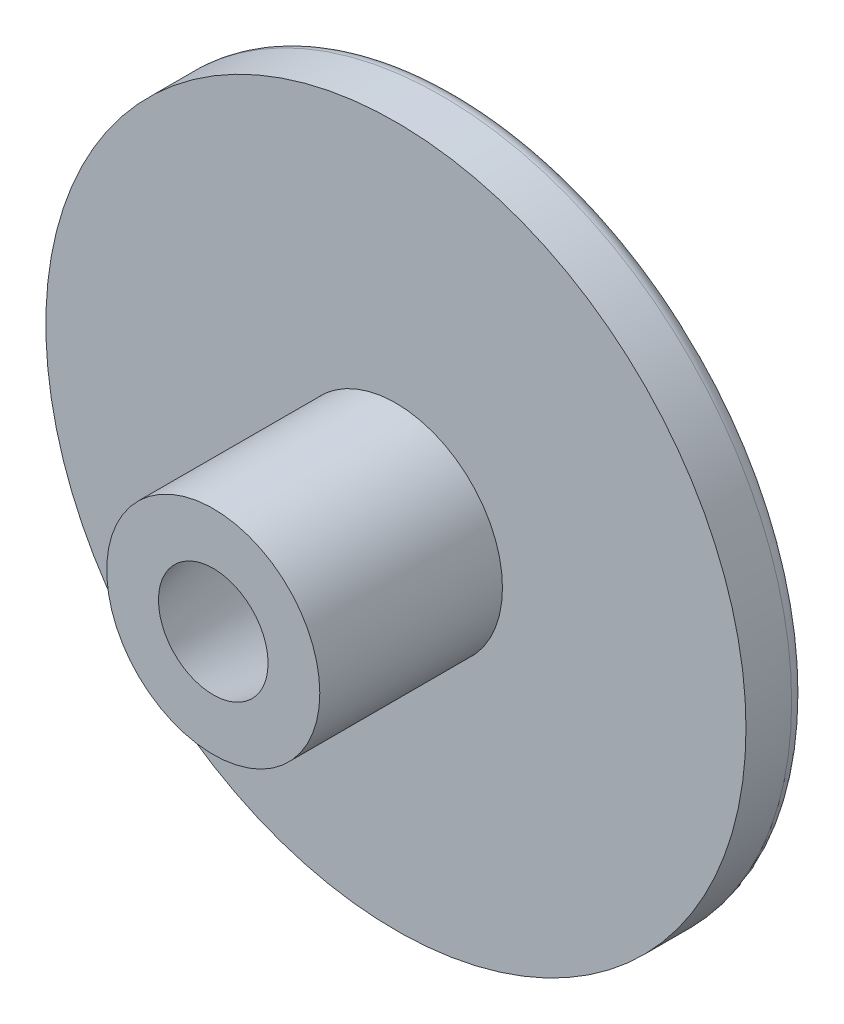
from build123d import *

# Parameters (mm, degrees)
ESQUISSE1_R             = 11.5
ESQUISSE1_R_2           = 3.5
EXTRU_MINCE1_DEPTH      = 2
BOSS_EXTRU_1_DEPTH      = 6
BOSS_EXTRU_1_DEPTH_BACK = 2
ESQUISSE2_R             = 3.5
ESQUISSE3_R             = 3.5
ENL_V_MAT_EXTRU_1_DEPTH = 8
ENL_V_MAT_EXTRU_1_DRAFT = -12
ENL_V_MAT_EXTRU_3_DEPTH = 0.5
CONG_1_R                = 0.5


with BuildPart() as part:
    # Esquisse1 → Extru.-Mince1 (new body)
    with BuildSketch(Plane.XY):
        Circle(ESQUISSE1_R)
        Circle(ESQUISSE1_R_2, mode=Mode.SUBTRACT)
    extrude(amount=EXTRU_MINCE1_DEPTH)

    # Esquisse4 → Enlèv. mat.-Extru.3 (cut)
    # profile 1 of 6: a face of its own
    with BuildSketch(Plane(origin=(0, 0, 0), x_dir=(-1, 0, 0), z_dir=(0, 0, -1))):
        with BuildLine():
            Line((8.614236144, 3.278675584), (8.788114349, 2.604897539))
            add(Edge.make_bspline(
                [(8.788114349, 2.604897539), (8.79966427, 2.559816951), (8.821835882, 2.47327876), (8.852021559, 2.348996491), (8.877355615, 2.235600173), (8.898549275, 2.133249532), (8.915365674, 2.04160878), (8.928351907, 1.961033259), (8.936436316, 1.891535911), (8.938580922, 1.848869045), (8.939556657, 1.829456834)],
                knots=[0, 0, 0, 0, 1.411457692, 2.709480947, 3.87888985, 4.935413449, 5.879444658, 6.704531935, 7.41059888, 8, 8, 8, 8], degree=3))
            add(Edge.make_bspline(
                [(8.939556657, 1.829456834), (8.939713797, 1.803271741), (8.940024383, 1.751517239), (8.9336806, 1.674798662), (8.92104517, 1.60048592), (8.902511857, 1.528353482), (8.879080272, 1.458194787), (8.848461369, 1.390638547), (8.81255859, 1.325278088), (8.771640938, 1.262234975), (8.724348427, 1.203389615), (8.672776946, 1.148695147), (8.61613876, 1.099238253), (8.554744757, 1.054751697), (8.488286054, 1.015567376), (8.416834995, 0.982290125), (8.341604793, 0.951861071), (8.288623452, 0.937334597), (8.261571881, 0.929917571)],
                knots=[0, 0, 0, 0, 1.027386749, 2.030616786, 3.016845276, 3.982381357, 4.951223185, 5.916105477, 6.889020454, 7.876144333, 8.861732762, 9.847961252, 10.823035865, 11.808325455, 12.819865946, 13.845613465, 14.899998771, 16, 16, 16, 16], degree=3))
            add(Edge.make_bspline(
                [(8.261571881, 0.929917571), (8.21642387, 0.920108041), (8.128211374, 0.900941679), (7.995026402, 0.89231684), (7.866216288, 0.903167406), (7.742160079, 0.930755896), (7.624921489, 0.977573896), (7.515745963, 1.041698092), (7.41700466, 1.124827685), (7.341957002, 1.206112608), (7.287706621, 1.281308893), (7.247452401, 1.344512835), (7.209843479, 1.415071454), (7.17363761, 1.491840234), (7.139016871, 1.575052601), (7.10707324, 1.665081978), (7.076215396, 1.761661179), (7.057526677, 1.828690991), (7.047930054, 1.86311068)],
                knots=[0, 0, 0, 0, 1.273361112, 2.487958111, 3.665382018, 4.829080103, 5.980857239, 7.134167278, 8.306407426, 9.529462913, 10.175565605, 10.86242879, 11.59517817, 12.379656551, 13.203449436, 14.08040443, 15.014291115, 16, 16, 16, 16], degree=3))
            Line((7.047930054, 1.86311068), (5.789416432, 0.239312603))
            Line((5.789416432, 0.239312603), (5.681443676, 0.657882315))
            Line((5.681443676, 0.657882315), (6.940658419, 2.278875905))
            Line((6.940658419, 2.278875905), (6.89017765, 2.47238552))
            Line((6.89017765, 2.47238552), (5.316860343, 2.065734879))
            Line((5.316860343, 2.065734879), (5.22992124, 2.403675584))
            Line((5.22992124, 2.403675584), (8.614236144, 3.278675584))
        make_face()
        with BuildLine():
            Line((8.369544637, 2.85519802), (7.219704894, 2.557922379))
            Line((7.219704894, 2.557922379), (7.365538227, 1.974589046))
            add(Edge.make_bspline(
                [(7.365538227, 1.974589046), (7.37291872, 1.947450958), (7.387207933, 1.894909488), (7.409495601, 1.819289938), (7.432180897, 1.749562813), (7.457429024, 1.686725942), (7.480635925, 1.628626794), (7.505834132, 1.576925357), (7.531736673, 1.531349451), (7.565824566, 1.47907459), (7.613955446, 1.423294952), (7.678505564, 1.36645891), (7.751199724, 1.321815888), (7.829785571, 1.28901327), (7.912707556, 1.267818198), (7.998007505, 1.259499572), (8.08476333, 1.263495876), (8.141569196, 1.275687487), (8.170426048, 1.281880712)],
                knots=[0, 0, 0, 0, 1.115103043, 2.158927107, 3.1259676, 4.020827691, 4.843437396, 5.60602404, 6.299117739, 6.92110017, 8.078006123, 9.207798313, 10.318773687, 11.444339494, 12.572610487, 13.699396336, 14.831314767, 16, 16, 16, 16], degree=3))
            add(Edge.make_bspline(
                [(8.170426048, 1.281880712), (8.198095498, 1.290148071), (8.252654821, 1.306449857), (8.328141777, 1.345388881), (8.397435687, 1.393285034), (8.45779988, 1.452342192), (8.50947742, 1.518238708), (8.550270829, 1.589969717), (8.578443953, 1.666481215), (8.592171885, 1.73426914), (8.596713477, 1.7926932), (8.596531037, 1.842610067), (8.592552516, 1.898247779), (8.586698977, 1.95964518), (8.575597269, 2.026673375), (8.561504996, 2.099077965), (8.544875224, 2.177554813), (8.531016565, 2.231250536), (8.523791432, 2.259244494)],
                knots=[0, 0, 0, 0, 1.166509751, 2.300153459, 3.420620353, 4.564477273, 5.7034747, 6.800419841, 7.889753751, 8.989753038, 9.587514341, 10.259070157, 11.007789343, 11.844481966, 12.754174505, 13.755886252, 14.830044127, 16, 16, 16, 16], degree=3))
            Line((8.523791432, 2.259244494), (8.369544637, 2.85519802))
        make_face(mode=Mode.SUBTRACT)
    # profile 2 of 6: a face of its own
    with BuildSketch(Plane(origin=(0, 0, 0), x_dir=(-1, 0, 0), z_dir=(0, 0, -1))):
        Polygon((6.295568985, 6.767557171), (7.628401517, 5.272064382), (7.371089818, 5.042096434), (6.271029722, 6.276771915), (5.454923953, 5.549708613), (6.545869466, 4.325549959), (6.290661132, 4.098386498), (5.199715619, 5.322545152), (4.175376677, 4.409684575), (5.26632219, 3.185525921), (5.009010491, 2.956259094), (3.685292543, 4.441235056), align=None)
    # profile 3 of 6: a face of its own
    with BuildSketch(Plane(origin=(0, 0, 0), x_dir=(-1, 0, 0), z_dir=(0, 0, -1))):
        with BuildLine():
            Line((2.32647647, 8.909842573), (2.97501413, 8.660243214))
            add(Edge.make_bspline(
                [(2.97501413, 8.660243214), (3.018285621, 8.643507987), (3.101264842, 8.611415816), (3.219629584, 8.563970477), (3.326547636, 8.518782895), (3.42218636, 8.477322445), (3.506388546, 8.437853303), (3.57871523, 8.400863131), (3.640380089, 8.36759852), (3.676477005, 8.344685979), (3.692962848, 8.334221579)],
                knots=[0, 0, 0, 0, 1.410038216, 2.703948268, 3.875381737, 4.937704434, 5.871858629, 6.700948161, 7.406709305, 8, 8, 8, 8], degree=3))
            add(Edge.make_bspline(
                [(3.692962848, 8.334221579), (3.714448708, 8.319095306), (3.75668701, 8.289359093), (3.815576177, 8.240124084), (3.867726476, 8.186133378), (3.917098567, 8.130641868), (3.958447047, 8.069454347), (3.997199585, 8.006449078), (4.029068636, 7.939049258), (4.055631009, 7.868913985), (4.077033535, 7.796857843), (4.090743404, 7.723050766), (4.098698276, 7.648504246), (4.09956486, 7.572867374), (4.092089947, 7.496434562), (4.078627948, 7.419139089), (4.059345763, 7.340547074), (4.040520074, 7.289157997), (4.030903553, 7.262907477)],
                knots=[0, 0, 0, 0, 1.033989131, 2.032683187, 3.014805219, 3.98653505, 4.951055292, 5.916452291, 6.895597863, 7.879570237, 8.866333054, 9.849488265, 10.829713308, 11.813943593, 12.820737353, 13.84750087, 14.900462374, 16, 16, 16, 16], degree=3))
            add(Edge.make_bspline(
                [(4.030903553, 7.262907477), (4.012856975, 7.220515316), (3.977516218, 7.137498409), (3.906608587, 7.024816763), (3.82366314, 6.925546755), (3.728240759, 6.841674365), (3.622662061, 6.772452288), (3.506550779, 6.722946479), (3.382660955, 6.688443648), (3.272847626, 6.676106068), (3.180392893, 6.675331876), (3.105874284, 6.679473096), (3.027289347, 6.689727547), (2.944175044, 6.704442584), (2.856665236, 6.724865591), (2.764897258, 6.751132063), (2.668748611, 6.781887022), (2.603807928, 6.805547603), (2.570466855, 6.817695137)],
                knots=[0, 0, 0, 0, 1.272887228, 2.492705217, 3.667312792, 4.839890359, 5.994743159, 7.14417251, 8.317338072, 9.541055985, 10.187590551, 10.873979883, 11.603697361, 12.378556661, 13.208147773, 14.088198578, 15.018465657, 16, 16, 16, 16], degree=3))
            Line((2.570466855, 6.817695137), (3.159409162, 4.854554111))
            Line((3.159409162, 4.854554111), (2.756965252, 5.009502028))
            Line((2.756965252, 5.009502028), (2.169425188, 6.971941932))
            Line((2.169425188, 6.971941932), (1.983627912, 7.042755233))
            Line((1.983627912, 7.042755233), (1.402397944, 5.529033278))
            Line((1.402397944, 5.529033278), (1.077077432, 5.654534079))
            Line((1.077077432, 5.654534079), (2.32647647, 8.909842573))
        make_face()
        with BuildLine():
            Line((2.529801791, 8.465331355), (2.104921983, 7.358961162))
            Line((2.104921983, 7.358961162), (2.663716053, 7.140211162))
            add(Edge.make_bspline(
                [(2.663716053, 7.140211162), (2.690070839, 7.130248889), (2.740898896, 7.111035566), (2.815426465, 7.085564471), (2.885488352, 7.064784845), (2.950793526, 7.046826671), (3.011636329, 7.033429), (3.068072343, 7.024351999), (3.11977267, 7.018302966), (3.182160782, 7.016604064), (3.255448088, 7.021838946), (3.338549484, 7.042829714), (3.416823704, 7.075221864), (3.4888928, 7.120446804), (3.554065707, 7.175741884), (3.610458712, 7.239995647), (3.657801887, 7.312416125), (3.68064491, 7.365579024), (3.692261726, 7.392615009)],
                knots=[0, 0, 0, 0, 1.120381207, 2.160776483, 3.131066198, 4.026063496, 4.853671672, 5.606919364, 6.298659637, 6.921614224, 8.087037011, 9.207302574, 10.315397295, 11.442388932, 12.576447613, 13.702519194, 14.831616464, 16, 16, 16, 16], degree=3))
            add(Edge.make_bspline(
                [(3.692261726, 7.392615009), (3.701538931, 7.419731433), (3.719862325, 7.473289047), (3.732086622, 7.556944302), (3.732258341, 7.640817579), (3.719336916, 7.723872255), (3.695772872, 7.803810003), (3.662078078, 7.879069947), (3.616002844, 7.946412683), (3.568819806, 7.997028728), (3.524453533, 8.035246799), (3.483341167, 8.063514372), (3.436507902, 8.093083455), (3.382715407, 8.122436825), (3.322365702, 8.152572263), (3.255116133, 8.18311128), (3.181649098, 8.214861214), (3.130034081, 8.234839066), (3.103319419, 8.245179111)],
                knots=[0, 0, 0, 0, 1.161624442, 2.29432293, 3.414068557, 4.556148798, 5.694121674, 6.789681635, 7.889834815, 8.991010651, 9.590044731, 10.264057234, 11.014437808, 11.838429894, 12.750841552, 13.75294775, 14.836981051, 16, 16, 16, 16], degree=3))
            Line((3.103319419, 8.245179111), (2.529801791, 8.465331355))
        make_face(mode=Mode.SUBTRACT)
    # profile 4 of 6: a face of its own
    with BuildSketch(Plane(origin=(0, 0, 0), x_dir=(-1, 0, 0), z_dir=(0, 0, -1))):
        Polygon((-1.507577222, 8.831108635), (-1.528610876, 9.169750462), (0.381244893, 9.289642289), (0.402278547, 8.951000462), (-0.37386328, 8.902623058), (-0.176146934, 5.760195174), (-0.530914562, 5.737759276), (-0.728630908, 8.880187161), align=None)
    # profile 5 of 6: a face of its own
    with BuildSketch(Plane(origin=(0, 0, 0), x_dir=(-1, 0, 0), z_dir=(0, 0, -1))):
        Polygon((-4.044993654, 4.067792479), (-5.847577789, 7.032836549), (-5.783074584, 7.07209937), (-2.432413526, 6.000084145), (-3.812221218, 8.269615395), (-3.51985343, 8.447700331), (-1.717269295, 5.482656261), (-1.783875866, 5.441991197), (-5.100883077, 6.495076132), (-3.73860343, 4.253589754), align=None)
    # profile 6 of 6: a face of its own
    with BuildSketch(Plane(origin=(0, 0, 0), x_dir=(-1, 0, 0), z_dir=(0, 0, -1))):
        Polygon((-8.493237734, 3.607876563), (-7.544619946, 5.362784416), (-7.243137574, 5.199423038), (-8.026290619, 3.75090541), (-7.068558247, 3.232776403), (-6.291715299, 4.668673839), (-5.99163517, 4.506714704), (-6.768478119, 3.070817268), (-5.567456484, 2.421578486), (-4.790613536, 3.857475922), (-4.489131164, 3.694114544), (-5.431438856, 1.951826884), align=None)
    extrude(amount=-ENL_V_MAT_EXTRU_3_DEPTH, mode=Mode.SUBTRACT)

    # Congé1
    cong_1_edges = [part.edges().sort_by_distance(p)[0] for p in [
        (-11.5, 0, 0),
    ]]
    fillet(cong_1_edges, radius=CONG_1_R)


with BuildPart() as body_2:
    # Esquisse2 → Boss.-Extru.1 (new, two sides: drawn at the far end of the back side and taken through both)
    with BuildSketch(Plane.XY.offset(2).offset(-BOSS_EXTRU_1_DEPTH_BACK)):
        Circle(ESQUISSE2_R)
    extrude(amount=BOSS_EXTRU_1_DEPTH + BOSS_EXTRU_1_DEPTH_BACK)


with BuildPart() as enl_v_mat_extru_1_tool:
    # Esquisse3 → Enlèv. mat.-Extru.1 (with draft: the straight prism first)
    with BuildSketch(Plane(origin=(0, 0, 0), x_dir=(-1, 0, 0), z_dir=(0, 0, -1))):
        with Locations(Location((0, 0, 0), (0, 0, 180))):
            Circle(ESQUISSE3_R)
    extrude(amount=-ENL_V_MAT_EXTRU_1_DEPTH)
    # Enlèv. mat.-Extru.1: the draft: its side faces are tilted about the plane it starts from
    enl_v_mat_extru_1_sides = [enl_v_mat_extru_1_tool.faces().sort_by_distance(p)[0] for p in [
        (-3.5, 0, 4),
    ]]
    draft(enl_v_mat_extru_1_sides, Plane(origin=(0, 0, 0), x_dir=(-1, 0, 0), z_dir=(0, 0, -1)), ENL_V_MAT_EXTRU_1_DRAFT)


with BuildPart() as body_2_1:
    add(body_2.part)

    # Enlèv. mat.-Extru.1: cut by enl_v_mat_extru_1_tool
    add(enl_v_mat_extru_1_tool.part, mode=Mode.SUBTRACT)


solid = Compound([part.part, body_2_1.part])
